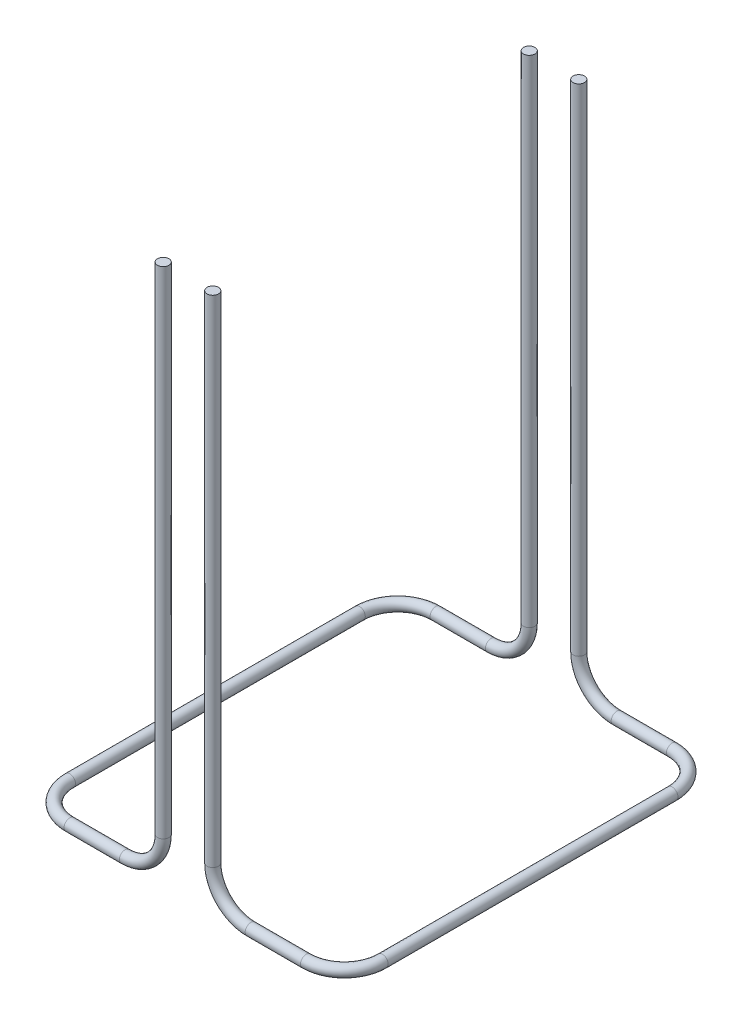
from build123d import *

# Parameters (mm, degrees)
SWEEP_1_PROFILE_R = 7.5
SWEEP_2_PROFILE_R = 7.5


with BuildPart() as part:
    # 扫描1: sweep along a curve in space
    with BuildLine() as sweep_1_path:
        Line((32.495116313, 700.563396672, 0), (32.495116313, 50.563396672, 0))
        ThreePointArc((32.495116313, 50.563396672, 0), (47.139777254, 15.208057613, 0), (82.495116313, 0.563396672, 0))
        Line((82.495116313, 0.563396672, 0), (154.999225814, 0.563396672, 0))
        ThreePointArc((154.999225814, 0.563396672, 0), (190.354564873, 0.563396672, -14.644660941), (204.999225814, 0.563396672, -50))
        Line((204.999225814, 0.563396672, -50), (204.999225814, 0.563396672, -430))
        ThreePointArc((204.999225814, 0.563396672, -430), (190.354564873, 0.563396672, -465.355339059), (154.999225814, 0.563396672, -480))
        Line((154.999225814, 0.563396672, -480), (82.495116313, 0.563396672, -480))
        ThreePointArc((82.495116313, 0.563396672, -480), (47.139777254, 15.208057613, -480), (32.495116313, 50.563396672, -480))
        Line((32.495116313, 50.563396672, -480), (32.495116313, 700.563396672, -480))
    # 扫描1 profile (on start of the path) → 扫描1 (sweep)
    with BuildSketch(Plane(origin=(32.495116313, 700.563396672, 0), x_dir=(0, 0, -1), z_dir=(0, -1, 0))):
        Circle(SWEEP_1_PROFILE_R)
    sweep(path=sweep_1_path.line)


with BuildPart() as body_2:
    # 扫描2: sweep along a curve in space
    with BuildLine() as sweep_2_path:
        Line((-32.495116313, 50.563396672, -480), (-32.495116313, 700.563396672, -480))
        ThreePointArc((-32.495116313, 50.563396672, -480), (-47.139777254, 15.208057613, -480), (-82.495116313, 0.563396672, -480))
        Line((-154.999225814, 0.563396672, -480), (-82.495116313, 0.563396672, -480))
        ThreePointArc((-154.999225814, 0.563396672, -480), (-190.354564873, 0.563396672, -465.355339059), (-204.999225814, 0.563396672, -430))
        Line((-204.999225814, 0.563396672, -50), (-204.999225814, 0.563396672, -430))
        ThreePointArc((-204.999225814, 0.563396672, -50), (-190.354564873, 0.563396672, -14.644660941), (-154.999225814, 0.563396672, 0))
        Line((-82.495116313, 0.563396672, 0), (-154.999225814, 0.563396672, 0))
        ThreePointArc((-82.495116313, 0.563396672, 0), (-47.139777254, 15.208057613, 0), (-32.495116313, 50.563396672, 0))
        Line((-32.495116313, 700.563396672, 0), (-32.495116313, 50.563396672, 0))
    # 扫描2 profile (on start of the path) → 扫描2 (sweep)
    with BuildSketch(Plane(origin=(-32.495116313, 700.563396672, 0), x_dir=(0, 0, -1), z_dir=(0, -1, 0))):
        Circle(SWEEP_2_PROFILE_R)
    sweep(path=sweep_2_path.line)


solid = Compound([part.part, body_2.part])
